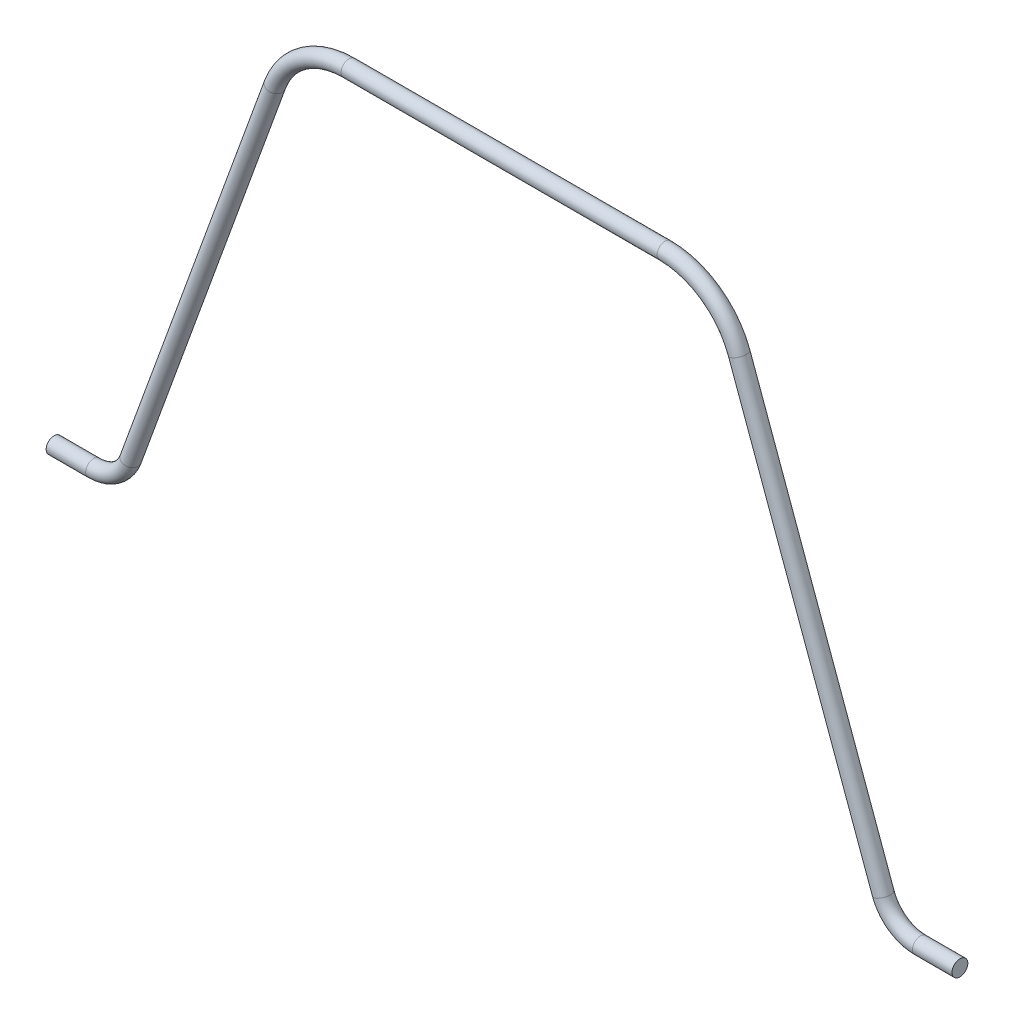
from build123d import *

# Parameters (mm, degrees)
SKETCH1_R = 2.54


with BuildPart() as part:
    # Sweep1: sweep along a path in Sketch2
    with BuildLine(Plane.XY) as sweep1_path:
        Line((145.646970908, -152.4), (132.946970908, -152.4))
        ThreePointArc((132.946970908, -152.4), (125.662550166, -150.103230962), (121.012874624, -144.04365582))
        Line((121.012874624, -144.04365582), (74.668192568, -16.71268836))
        ThreePointArc((74.668192568, -16.71268836), (65.368841483, -4.593538075), (50.8, 0))
        Line((50.8, 0), (-50.8, 0))
        ThreePointArc((-50.8, 0), (-65.368841483, -4.593538075), (-74.668192568, -16.71268836))
        Line((-74.668192568, -16.71268836), (-121.012874624, -144.04365582))
        ThreePointArc((-121.012874624, -144.04365582), (-125.662550166, -150.103230962), (-132.946970908, -152.4))
        Line((-132.946970908, -152.4), (-145.646970908, -152.4))
    # Sketch1 → Sweep1 (sweep)
    with BuildSketch(Plane(origin=(0, 0, 0), x_dir=(0, 0, -1), z_dir=(1, 0, 0))):
        Circle(SKETCH1_R)
    sweep(path=sweep1_path.line)


solid = part.part
